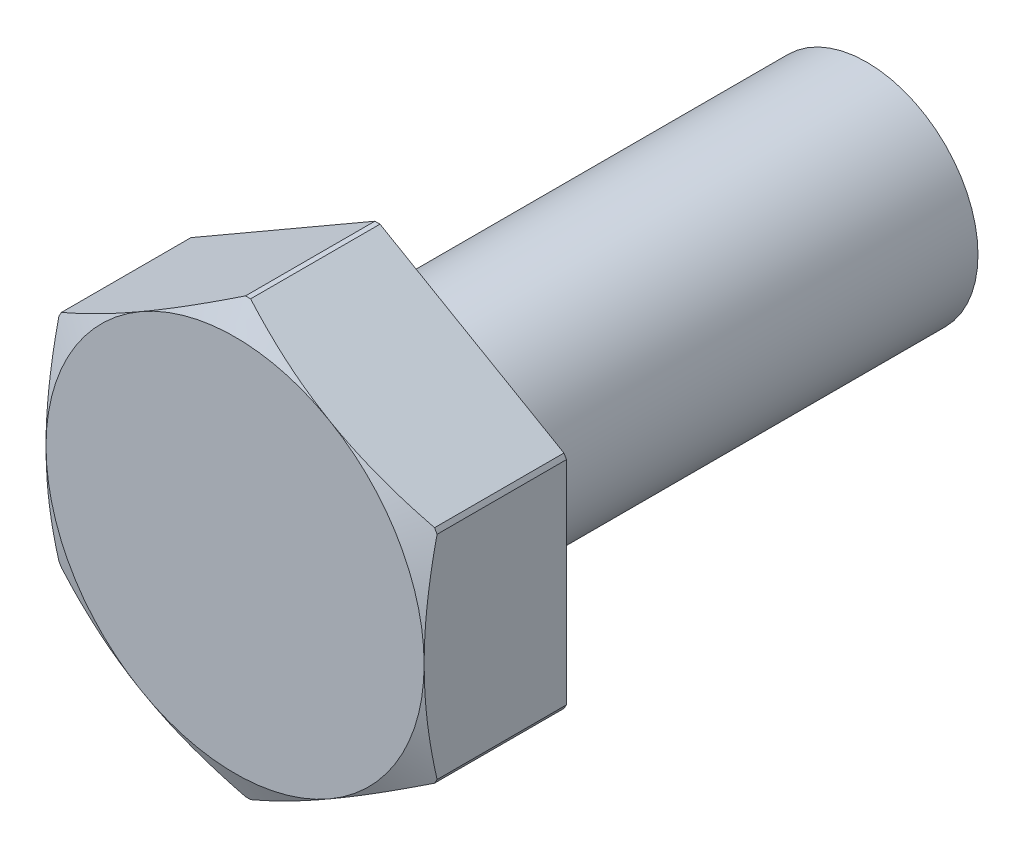
from build123d import *

# Parameters (mm, degrees)
SKETCH1_W      = 22
SKETCH1_H      = 5
EXTRUDE1_DEPTH = 6.4


with BuildPart() as part:
    # Sketch1 → Revolve1 (revolve)
    with BuildSketch(Plane(origin=(0, 0, 0), x_dir=(0, 0, -1), z_dir=(1, 0, 0))):
        with Locations((11, 2.5)):
            Rectangle(SKETCH1_W, SKETCH1_H)
    revolve(axis=Axis((0, 0, 0), (0, 0, 1)))

    # Sketch4 → Extrude1 (add)
    with BuildSketch(Plane.XY):
        Polygon((0, 9.814954576), (-8.5, 4.907477288), (-8.5, -4.907477288), (0, -9.814954576), (8.5, -4.907477288), (8.5, 4.907477288), align=None)
    extrude(amount=EXTRUDE1_DEPTH)

    # Sketch5 → Cut-Revolve3 (revolve, cut)
    with BuildSketch(Plane(origin=(0, 0, 0), x_dir=(0, 0, -1), z_dir=(1, 0, 0))):
        Polygon((-6.4, 8.5), (-5.81748528, 9.749206847), (0, 9.749206847), (0, 9.814954576), (-6.4, 9.814954576), align=None)
    revolve(axis=Axis((0, 0, 0), (0, 0, 1)), mode=Mode.SUBTRACT)


solid = part.part
